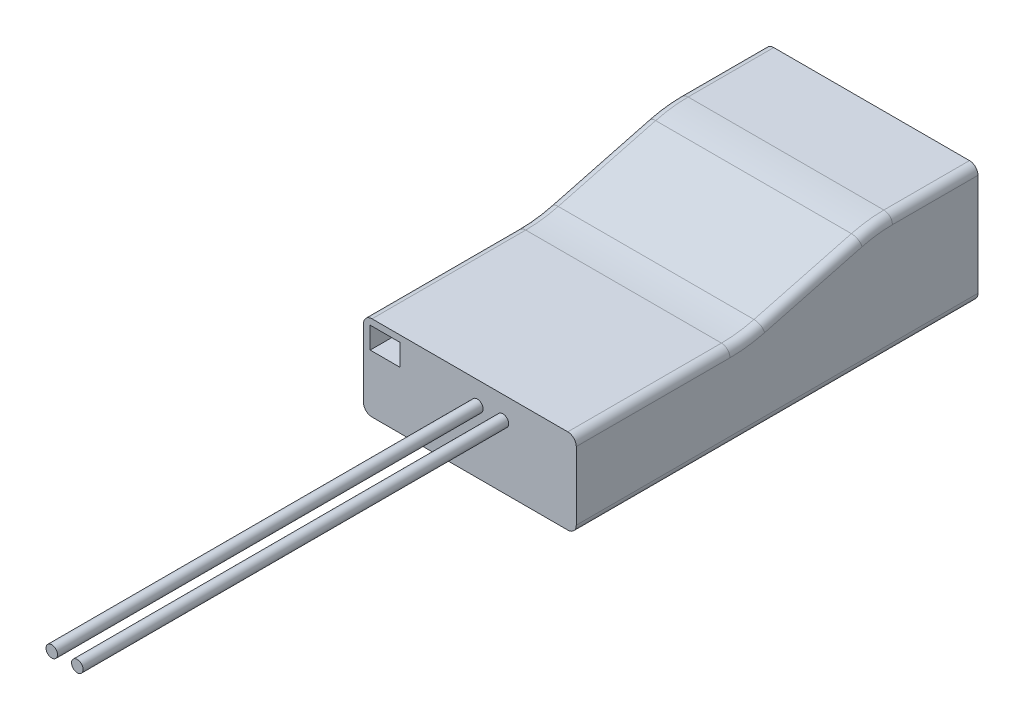
from build123d import *

# Parameters (mm, degrees)
SKETCH_1_W          = 25
SKETCH_1_H          = 47.2
EXTRUDE_1_DEPTH     = 14
CUT_EXTRUDE_1_DEPTH = 38.12088361
FILLET_1_R          = 15
SKETCH_3_W          = 24
SKETCH_3_H          = 13
SKETCH_3_R          = 0.5
CUT_EXTRUDE_2_DEPTH = 5
SKETCH_4_W          = 3.486393911
SKETCH_4_H          = 2.535559208
CUT_EXTRUDE_3_DEPTH = 5
SKETCH_5_R          = 0.679167645
EXTRUDE_2_DEPTH     = 50
FILLET_2_R          = 1


with BuildPart() as part:
    # 草圖1 → 填料-伸長1 (new body)
    with BuildSketch(Plane(origin=(0, 0, 0), x_dir=(1, 0, 0), z_dir=(0, 1, 0))):
        Rectangle(SKETCH_1_W, SKETCH_1_H)
    extrude(amount=EXTRUDE_1_DEPTH)

    # 草圖2 → 除料-伸長1 (cut, through all)
    with BuildSketch(Plane(origin=(12.5, 0, 0), x_dir=(0, 0, -1), z_dir=(1, 0, 0))):
        Polygon((-23.6, 10), (-3.6, 10), (11.6, 14), (-23.6, 14), align=None)
    extrude(amount=-CUT_EXTRUDE_1_DEPTH, mode=Mode.SUBTRACT)

    # 圓角1
    fillet_1_edges = [part.edges().sort_by_distance(p)[0] for p in [
        (0, 14, -11.6),
        (0, 10, 3.6),
    ]]
    fillet(fillet_1_edges, radius=FILLET_1_R)

    # 草圖3 → 除料-伸長2 (cut)
    with BuildSketch(Plane(origin=(0, 0, -23.6), x_dir=(-1, 0, 0), z_dir=(0, 0, -1))):
        with Locations((0, 7)):
            Rectangle(SKETCH_3_W, SKETCH_3_H)
        with Locations((-10.948606137, 12.643250156)):
            Circle(SKETCH_3_R, mode=Mode.SUBTRACT)
        with Locations((-7.948606137, 12.643250156)):
            Circle(SKETCH_3_R, mode=Mode.SUBTRACT)
        with Locations((-4.948606137, 12.643250156)):
            Circle(SKETCH_3_R, mode=Mode.SUBTRACT)
        with Locations((-1.948606137, 12.643250156)):
            Circle(SKETCH_3_R, mode=Mode.SUBTRACT)
        with Locations((1.051393863, 12.643250156)):
            Circle(SKETCH_3_R, mode=Mode.SUBTRACT)
        with Locations((4.051393863, 12.643250156)):
            Circle(SKETCH_3_R, mode=Mode.SUBTRACT)
        with Locations((7.051393863, 12.643250156)):
            Circle(SKETCH_3_R, mode=Mode.SUBTRACT)
        with Locations((10.051393863, 12.643250156)):
            Circle(SKETCH_3_R, mode=Mode.SUBTRACT)
        with Locations((-7.948606137, 9.843250156)):
            Circle(SKETCH_3_R, mode=Mode.SUBTRACT)
        with Locations((-4.948606137, 9.843250156)):
            Circle(SKETCH_3_R, mode=Mode.SUBTRACT)
        with Locations((-1.948606137, 9.843250156)):
            Circle(SKETCH_3_R, mode=Mode.SUBTRACT)
        with Locations((1.051393863, 9.843250156)):
            Circle(SKETCH_3_R, mode=Mode.SUBTRACT)
        with Locations((4.051393863, 9.843250156)):
            Circle(SKETCH_3_R, mode=Mode.SUBTRACT)
        with Locations((7.051393863, 9.843250156)):
            Circle(SKETCH_3_R, mode=Mode.SUBTRACT)
        with Locations((10.051393863, 9.843250156)):
            Circle(SKETCH_3_R, mode=Mode.SUBTRACT)
        with Locations((-7.948606137, 7.043250156)):
            Circle(SKETCH_3_R, mode=Mode.SUBTRACT)
        with Locations((-4.948606137, 7.043250156)):
            Circle(SKETCH_3_R, mode=Mode.SUBTRACT)
        with Locations((-1.948606137, 7.043250156)):
            Circle(SKETCH_3_R, mode=Mode.SUBTRACT)
        with Locations((1.051393863, 7.043250156)):
            Circle(SKETCH_3_R, mode=Mode.SUBTRACT)
        with Locations((4.051393863, 7.043250156)):
            Circle(SKETCH_3_R, mode=Mode.SUBTRACT)
        with Locations((7.051393863, 7.043250156)):
            Circle(SKETCH_3_R, mode=Mode.SUBTRACT)
        with Locations((10.051393863, 7.043250156)):
            Circle(SKETCH_3_R, mode=Mode.SUBTRACT)
        with Locations((-7.948606137, 4.243250156)):
            Circle(SKETCH_3_R, mode=Mode.SUBTRACT)
        with Locations((-4.948606137, 4.243250156)):
            Circle(SKETCH_3_R, mode=Mode.SUBTRACT)
        with Locations((-1.948606137, 4.243250156)):
            Circle(SKETCH_3_R, mode=Mode.SUBTRACT)
        with Locations((1.051393863, 4.243250156)):
            Circle(SKETCH_3_R, mode=Mode.SUBTRACT)
        with Locations((4.051393863, 4.243250156)):
            Circle(SKETCH_3_R, mode=Mode.SUBTRACT)
        with Locations((7.051393863, 4.243250156)):
            Circle(SKETCH_3_R, mode=Mode.SUBTRACT)
        with Locations((10.051393863, 4.243250156)):
            Circle(SKETCH_3_R, mode=Mode.SUBTRACT)
        with Locations((-7.948606137, 1.443250156)):
            Circle(SKETCH_3_R, mode=Mode.SUBTRACT)
        with Locations((-4.948606137, 1.443250156)):
            Circle(SKETCH_3_R, mode=Mode.SUBTRACT)
        with Locations((-1.948606137, 1.443250156)):
            Circle(SKETCH_3_R, mode=Mode.SUBTRACT)
        with Locations((1.051393863, 1.443250156)):
            Circle(SKETCH_3_R, mode=Mode.SUBTRACT)
        with Locations((4.051393863, 1.443250156)):
            Circle(SKETCH_3_R, mode=Mode.SUBTRACT)
        with Locations((7.051393863, 1.443250156)):
            Circle(SKETCH_3_R, mode=Mode.SUBTRACT)
        with Locations((10.051393863, 1.443250156)):
            Circle(SKETCH_3_R, mode=Mode.SUBTRACT)
        with Locations((-10.948606137, 9.843250156)):
            Circle(SKETCH_3_R, mode=Mode.SUBTRACT)
        with Locations((-10.948606137, 7.043250156)):
            Circle(SKETCH_3_R, mode=Mode.SUBTRACT)
        with Locations((-10.948606137, 4.243250156)):
            Circle(SKETCH_3_R, mode=Mode.SUBTRACT)
        with Locations((-10.948606137, 1.443250156)):
            Circle(SKETCH_3_R, mode=Mode.SUBTRACT)
    extrude(amount=-CUT_EXTRUDE_2_DEPTH, mode=Mode.SUBTRACT)

    # 草圖4 → 除料-伸長3 (cut)
    with BuildSketch(Plane.XY.offset(23.6)):
        with Locations((-9.968677216, 7.978706613)):
            Rectangle(SKETCH_4_W, SKETCH_4_H)
    extrude(amount=-CUT_EXTRUDE_3_DEPTH, mode=Mode.SUBTRACT)

    # 草圖5 → 填料-伸長2 (add)
    with BuildSketch(Plane.XY.offset(23.6)):
        with Locations(Location((0.875366181, 7.344816811, 0), (0, 0, 180))):
            Circle(SKETCH_5_R)
        with Locations(Location((3.875366181, 7.344816811, 0), (0, 0, 180))):
            Circle(SKETCH_5_R)
    extrude(amount=EXTRUDE_2_DEPTH)

    # 圓角2
    fillet_2_edges = [part.edges().sort_by_distance(p)[0] for p in [
        (-12.5, 14, -18.570324057),
        (-12.5, 10, 14.570324057),
        (12.5, 10, 14.570324057),
        (12.5, 14, -18.570324057),
        (12.5, 12, -4),
        (12.5, 13.876017123, -11.616040476),
        (-12.5, 12, -4),
        (-12.5, 13.876017123, -11.616040476),
        (12.5, 10.123982877, 3.616040476),
        (-12.5, 10.123982877, 3.616040476),
        (-12.5, 0, 0),
        (12.5, 0, 0),
    ]]
    fillet(fillet_2_edges, radius=FILLET_2_R)


solid = part.part
